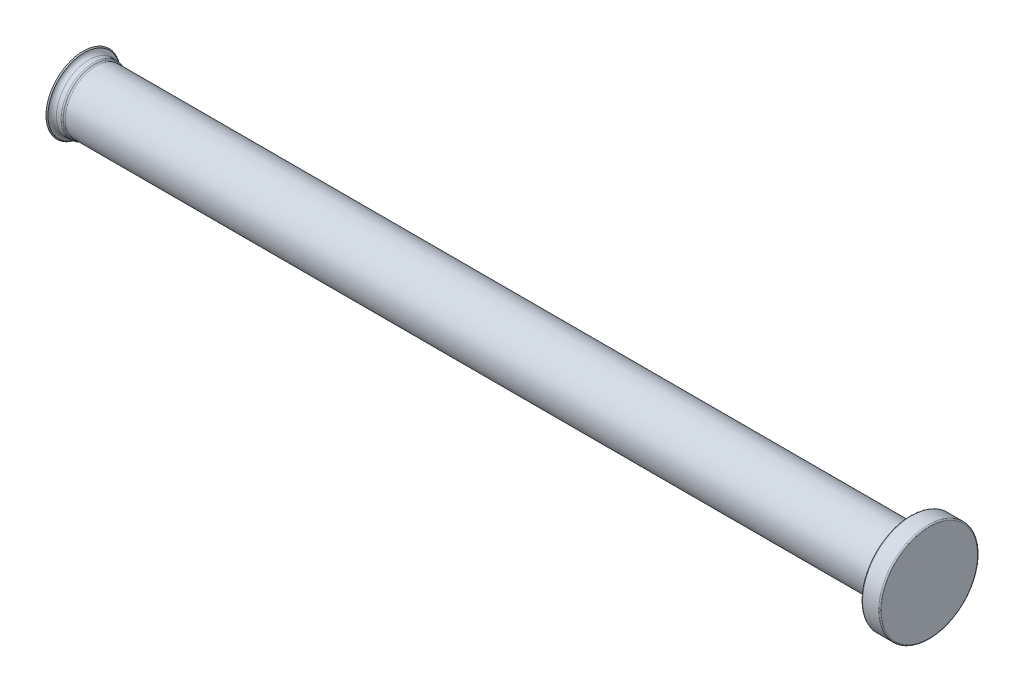
from build123d import *

# Parameters (mm, degrees)
RADYUS1_R = 0.1


with BuildPart() as part:
    # Çizim1 → Döndür1 (revolve)
    with BuildSketch(Plane.XY):
        Polygon((0, 0), (-67.5, 0), (-67.5, 2.5), (-1.5, 2.5), (-1.5, 4), (0, 4), align=None)
    revolve(axis=Axis((0, 0, 0), (1, 0, 0)))

    # Radyus1
    radyus1_edges = [part.edges().sort_by_distance(p)[0] for p in [
        (0, -4, 0),
        (-1.5, -4, 0),
    ]]
    fillet(radyus1_edges, radius=RADYUS1_R)

    # Kes-Ekstrüzyon1 cone 1 section (through the dimple's axis) → Kes-Ekstrüzyon1 (revolve, cut)
    with BuildSketch(Plane(origin=(-67.5, 0, 0), x_dir=(0, 0, 1), z_dir=(0, 1, 0))):
        Polygon((0, 0), (2.5, 0), (0, 0.440817452), align=None)
    revolve(axis=Axis((-67.5, 0, 0), (1, 0, 0)), mode=Mode.SUBTRACT)


with BuildPart() as body_2:
    # Çizim4 → Döndür2 (revolve)
    with BuildSketch(Plane.XY):
        with BuildLine():
            Line((-68, 2.5), (-67.622086007, 2.5))
            ThreePointArc((-67.622086007, 2.5), (-67.544002307, 2.472672569), (-67.5, 2.402617951))
            Line((-67.5, 2.402617951), (-67.408332982, 2.000595733))
            Line((-67.408332982, 2.000595733), (-67.408332982, 2.5))
            ThreePointArc((-67.408332982, 2.5), (-67.470942718, 2.516776229), (-67.516776224, 2.562609739))
            ThreePointArc((-67.516776224, 2.562609739), (-67.562609731, 2.608443249), (-67.625219467, 2.625219478))
            Line((-67.625219467, 2.625219478), (-68, 2.625219478))
            ThreePointArc((-68, 2.625219478), (-68.244473145, 2.708623708), (-68.386995818, 2.924055071))
            Line((-68.386995818, 2.924055071), (-68.471562156, 3))
            Line((-68.471562156, 3), (-68.508144353, 2.892385686))
            ThreePointArc((-68.508144353, 2.892385686), (-68.321005144, 2.609513816), (-68, 2.5))
        make_face()
    revolve(axis=Axis((-67.5, 0, 0), (1, 0, 0)))


solid = Compound([part.part, body_2.part])
